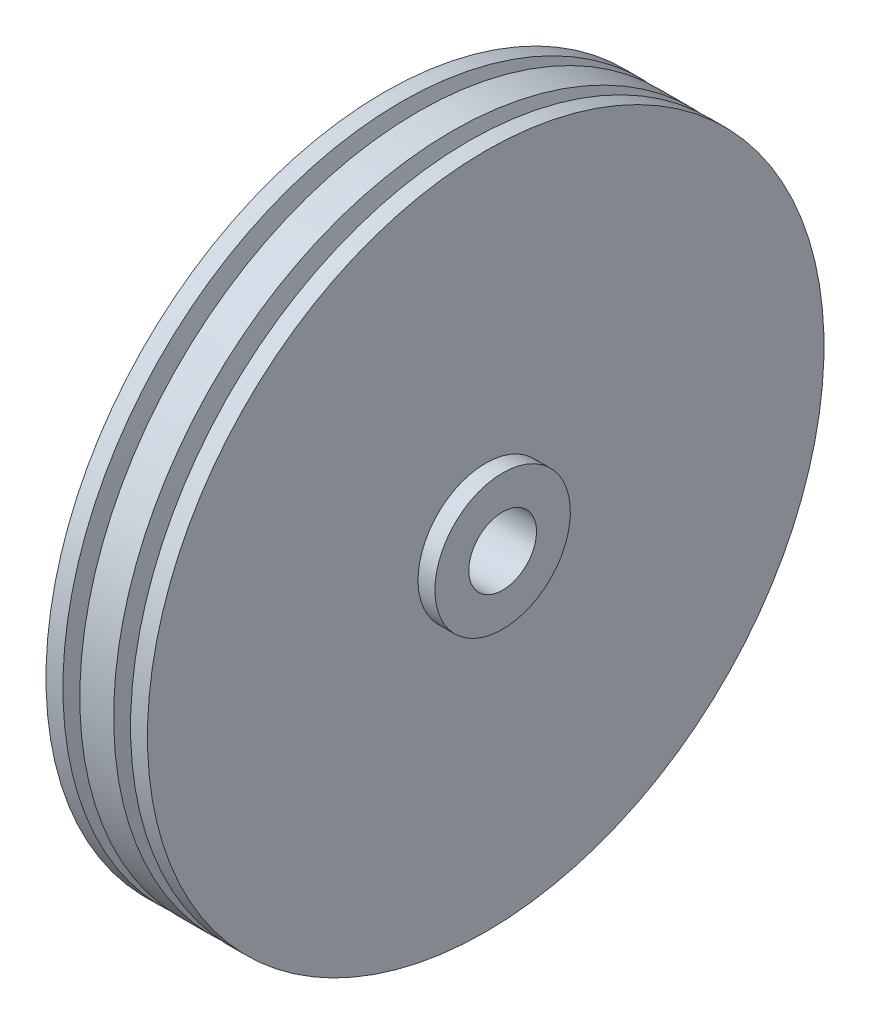
from build123d import *


with BuildPart() as part:
    # Croquis1 → Revolución3 (revolve)
    with BuildSketch(Plane.XY):
        Polygon((-15.224198293, 10.01641294), (-35.224198293, 10.01641294), (-35.224198293, 20.01641294), (-30.224198293, 20.01641294), (-30.224198293, 80.01641294), (-50.224198293, 80.01641294), (-50.224198293, 100.01641294), (-45.224198293, 100.01641294), (-42.724198293, 90.01641294), (-40.224198293, 100.01641294), (-30.224198293, 100.01641294), (-27.724198293, 90.01641294), (-25.224198293, 100.01641294), (-20.224198293, 100.01641294), (-20.224198293, 80.01641294), (-20.224198293, 20.01641294), (-15.224198293, 20.01641294), align=None)
    revolve(axis=Axis((68.905582562, 0, 0), (-1, 0, 0)))


solid = part.part
